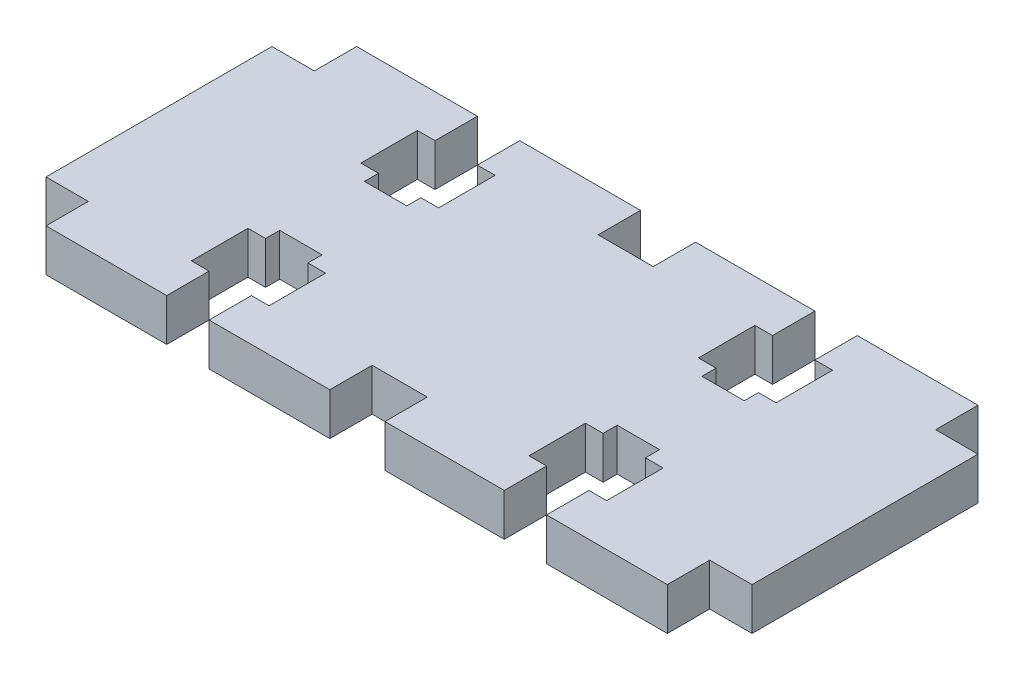
from build123d import *

# Parameters (mm, degrees)
EXTRUDE_1_DEPTH = 3


with BuildPart() as part:
    # 草图1 → 凸台-拉伸1 (new body)
    with BuildSketch(Plane(origin=(0, 0, 0), x_dir=(1, 0, 0), z_dir=(0, 1, 0))):
        Polygon((25, -8), (25, 0), (23.098111609, 0), (15.799055804, 0), (15.799055804, -4), (14.549055804, -4), (14.549055804, -5), (11.549055804, -5), (11.549055804, -4), (10.299055804, -4), (10.299055804, 0), (3, 0), (0, 0), (0, -8), align=None)
        Polygon((25, -16), (25, -8), (0, -8), (0, -16), (3, -16), (10.299055804, -16), (10.299055804, -12), (11.549055804, -12), (11.549055804, -11), (14.549055804, -11), (14.549055804, -12), (15.799055804, -12), (15.799055804, -16), (23.098111609, -16), align=None)
        Polygon((23.098111609, -19), (23.098111609, -16), (15.799055804, -16), (14.549055804, -16), (14.549055804, -19), align=None)
        Polygon((10.299055804, -16), (3, -16), (3, -19), (11.549055804, -19), (11.549055804, -16), align=None)
        Polygon((3, 3), (3, 0), (10.299055804, 0), (11.549055804, 0), (11.549055804, 3), align=None)
        Polygon((15.799055804, 0), (23.098111609, 0), (23.098111609, 3), (14.549055804, 3), (14.549055804, 0), align=None)
        Polygon((27, 3), (27, 0), (34.200944196, 0), (35.450944196, 0), (35.450944196, 3), align=None)
        Polygon((39.700944196, 0), (47, 0), (47, 3), (38.450944196, 3), (38.450944196, 0), align=None)
        Polygon((27, 0), (25, 0), (25, -8), (50, -8), (50, 0), (47, 0), (39.700944196, 0), (39.700944196, -4), (38.450944196, -4), (38.450944196, -5), (35.450944196, -5), (35.450944196, -4), (34.200944196, -4), (34.200944196, 0), align=None)
        Polygon((50, -8), (25, -8), (25, -16), (27, -16), (34.200944196, -16), (34.200944196, -12), (35.450944196, -12), (35.450944196, -11), (38.450944196, -11), (38.450944196, -12), (39.700944196, -12), (39.700944196, -16), (47, -16), (50, -16), align=None)
        Polygon((34.200944196, -16), (27, -16), (27, -19), (35.450944196, -19), (35.450944196, -16), align=None)
        Polygon((47, -19), (47, -16), (39.700944196, -16), (38.450944196, -16), (38.450944196, -19), align=None)
    extrude(amount=EXTRUDE_1_DEPTH)


solid = part.part
